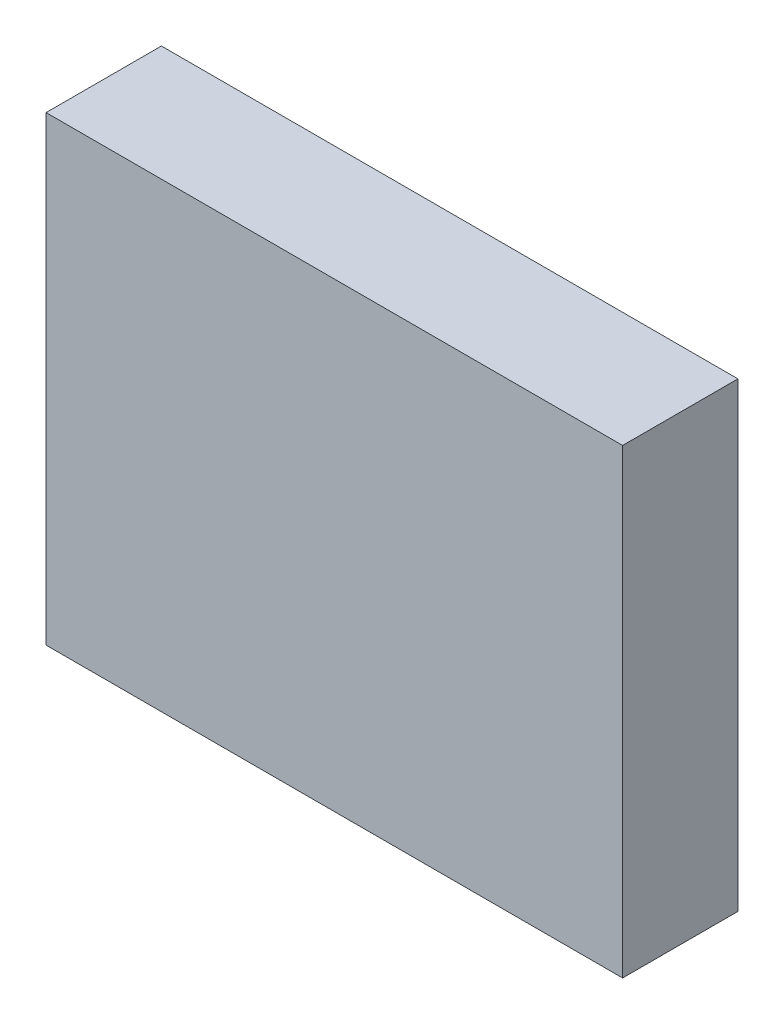
from build123d import *

# Parameters (mm, degrees)
SKETCH_1_W      = 100
SKETCH_1_H      = 80
EXTRUDE_1_DEPTH = 20


with BuildPart() as part:
    # 草图1 → 凸台-拉伸1 (new body)
    with BuildSketch(Plane.XY):
        with Locations((50, 40)):
            Rectangle(SKETCH_1_W, SKETCH_1_H)
    extrude(amount=EXTRUDE_1_DEPTH)


solid = part.part
